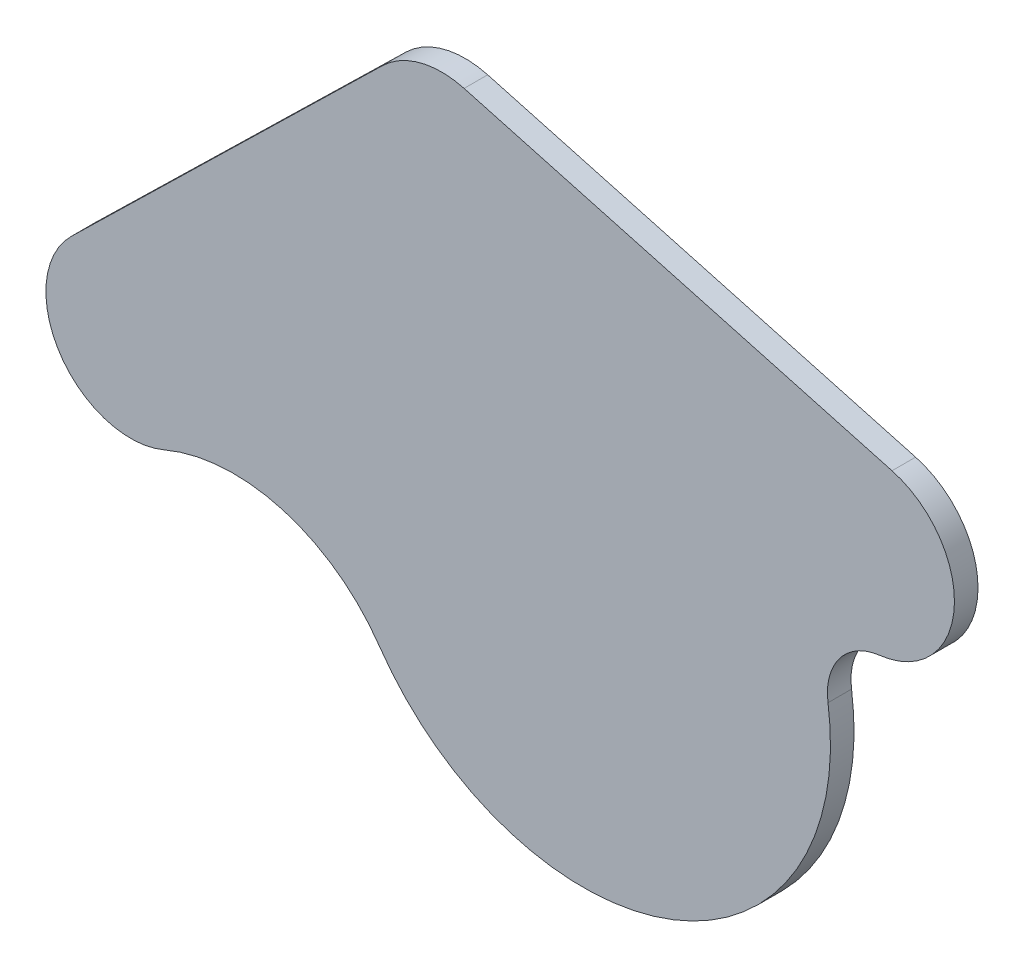
from build123d import *

# Parameters (mm, degrees)
BOSS_EXTRUDE1_DEPTH = 2.54


with BuildPart() as part:
    # Sketch1 → Boss-Extrude1 (new body)
    with BuildSketch(Plane.XY):
        with BuildLine():
            Line((-21.626606299, 39.235635924), (-55.151610835, 6.546926661))
            ThreePointArc((-55.151610835, 6.546926661), (-56.372418637, -5.077947735), (-45.167163851, -8.405160024))
            ThreePointArc((-45.167163851, -8.405160024), (-32.369930474, -7.616722365), (-21.971496094, -15.11761421))
            ThreePointArc((-21.971496094, -15.11761421), (9.701054911, -24.84307617), (26.401927799, 3.771883943))
            ThreePointArc((26.401927799, 3.771883943), (27.657017106, 8.544315238), (31.950451877, 10.97696143))
            ThreePointArc((31.950451877, 10.97696143), (40.006256636, 19.370249278), (33.302795508, 28.878502541))
            Line((33.302795508, 28.878502541), (-12.828436974, 41.508156144))
            ThreePointArc((-12.828436974, 41.508156144), (-17.529790419, 41.542143898), (-21.626606299, 39.235635924))
        make_face()
    extrude(amount=BOSS_EXTRUDE1_DEPTH)


solid = part.part
